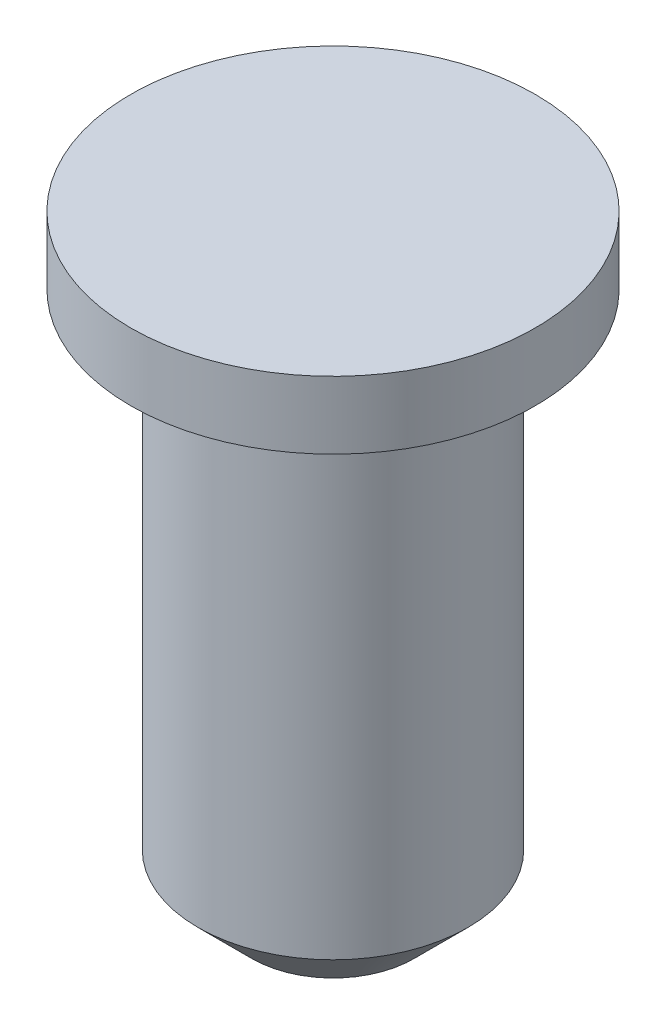
from build123d import *

# Parameters (mm, degrees)
SKETCH1_R           = 2
BOSS_EXTRUDE1_DEPTH = 8
SKETCH2_R           = 3
BOSS_EXTRUDE2_DEPTH = 1
CHAMFER1_SIZE       = 0.8


with BuildPart() as part:
    # Sketch1 → Boss-Extrude1 (new body)
    with BuildSketch(Plane(origin=(0, 0, 0), x_dir=(1, 0, 0), z_dir=(0, 1, 0))):
        with Locations(Location((0, 0, 0), (0, 0, 270))):
            Circle(SKETCH1_R)
    extrude(amount=BOSS_EXTRUDE1_DEPTH)

    # Sketch2 → Boss-Extrude2 (add)
    with BuildSketch(Plane(origin=(0, 8, 0), x_dir=(1, 0, 0), z_dir=(0, 1, 0))):
        with Locations(Location((0, 0, 0), (0, 0, 270))):
            Circle(SKETCH2_R)
    extrude(amount=BOSS_EXTRUDE2_DEPTH)

    # Chamfer1
    chamfer1_edges = [part.edges().sort_by_distance(p)[0] for p in [
        (0, 0, -2),
    ]]
    chamfer(chamfer1_edges, length=CHAMFER1_SIZE)


solid = part.part
